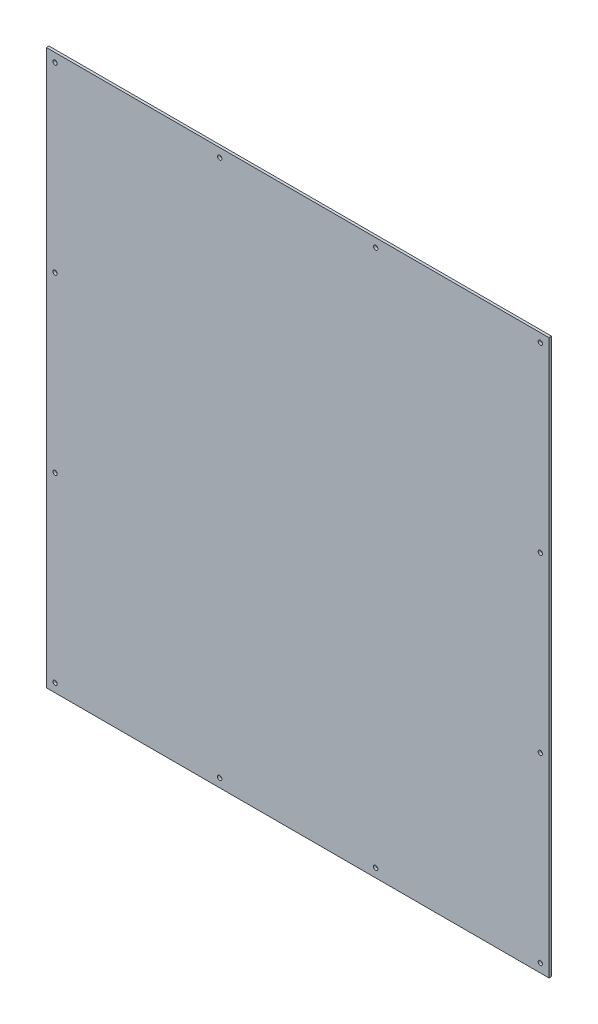
from build123d import *

# Parameters (mm, degrees)
SKETCH2_W           = 580
SKETCH2_H           = 640
BOSS_EXTRUDE1_DEPTH = 3
SKETCH3_R           = 2.5
CUT_EXTRUDE1_DEPTH  = 504.059033887


with BuildPart() as part:
    # Sketch2 → Boss-Extrude1 (new body)
    with BuildSketch(Plane.XY):
        with Locations((70.441640379, -30.914826498)):
            Rectangle(SKETCH2_W, SKETCH2_H)
    extrude(amount=BOSS_EXTRUDE1_DEPTH)

    # Sketch3 → Cut-Extrude1 (cut, through all)
    with BuildSketch(Plane.XY.offset(3)):
        with Locations((-209.558359621, 279.085173502)):
            Circle(SKETCH3_R)
        with Locations((-209.558359621, 69.085173502)):
            Circle(SKETCH3_R)
        with Locations((-209.558359621, -340.914826498)):
            Circle(SKETCH3_R)
        with Locations((-209.558359621, -130.914826498)):
            Circle(SKETCH3_R)
        with Locations((350.441640379, 279.085173502)):
            Circle(SKETCH3_R)
        with Locations((350.441640379, 69.085173502)):
            Circle(SKETCH3_R)
        with Locations((350.441640379, -130.914826498)):
            Circle(SKETCH3_R)
        with Locations((350.441640379, -340.914826498)):
            Circle(SKETCH3_R)
        with Locations((-19.558359621, -340.914826498)):
            Circle(SKETCH3_R)
        with Locations((160.441640379, -340.914826498)):
            Circle(SKETCH3_R)
        with Locations((-19.558359621, 279.085173502)):
            Circle(SKETCH3_R)
        with Locations((160.441640379, 279.085173502)):
            Circle(SKETCH3_R)
    extrude(amount=-CUT_EXTRUDE1_DEPTH, mode=Mode.SUBTRACT)


solid = part.part
